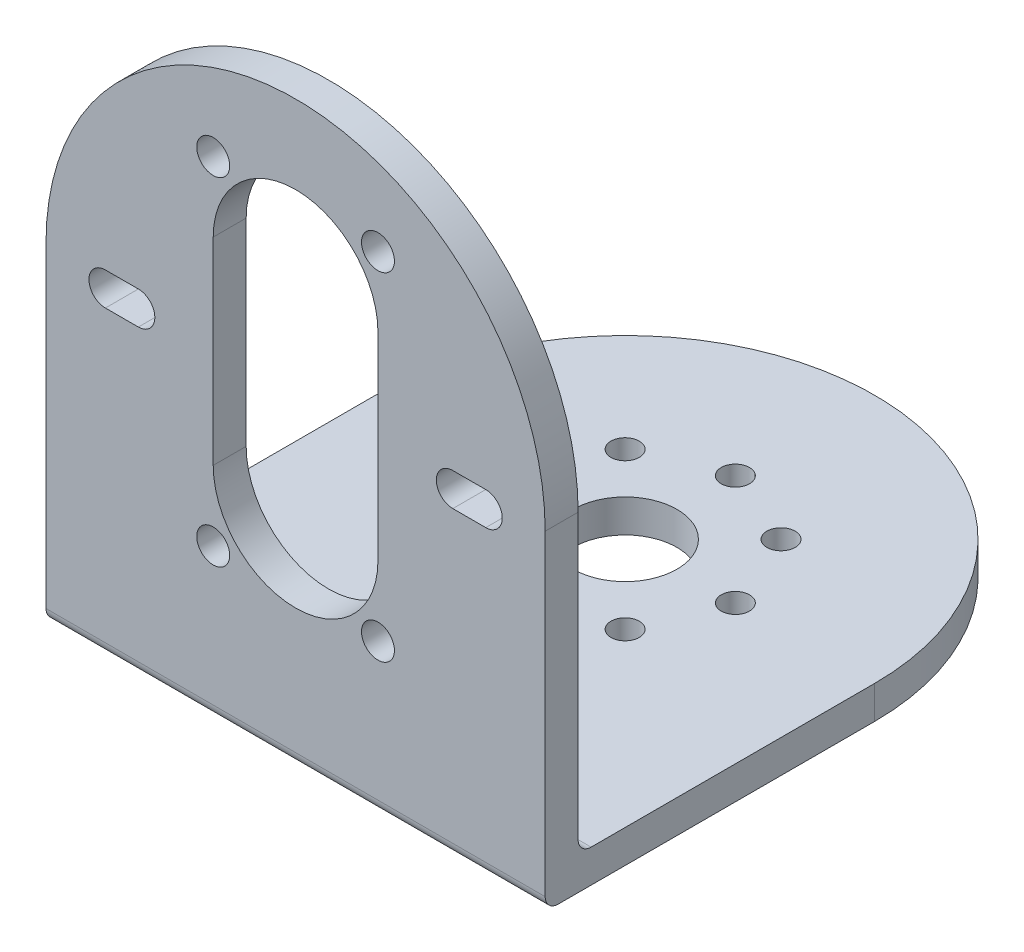
from build123d import *

# Parameters (mm, degrees)
SKETCH1_R           = 4
BOSS_EXTRUDE1_DEPTH = 2.54
SKETCH2_R           = 1.09
CUT_EXTRUDE1_DEPTH  = 5
CIRPATTERN1_COUNT   = 8
SKETCH3_R           = 1.27
BOSS_EXTRUDE2_DEPTH = 2.54
FILLET1_R           = 1


with BuildPart() as part:
    # Sketch1 → Boss-Extrude1 (new body)
    with BuildSketch(Plane(origin=(0, 0, 0), x_dir=(1, 0, 0), z_dir=(0, 1, 0))):
        with BuildLine():
            Line((-19.24, 0), (-19.24, -25.4))
            Line((-19.24, -25.4), (19.24, -25.4))
            Line((19.24, -25.4), (19.24, 0))
            ThreePointArc((19.24, 0), (0, 19.24), (-19.24, 0))
        make_face()
        with Locations(Location((0, 0, 0), (0, 0, 270))):
            Circle(SKETCH1_R, mode=Mode.SUBTRACT)
    extrude(amount=BOSS_EXTRUDE1_DEPTH)

    # Sketch2 → Cut-Extrude1 (cut, symmetric)
    with BuildSketch(Plane(origin=(0, 2.54, 0), x_dir=(1, 0, 0), z_dir=(0, 1, 0))):
        with Locations(Location((0, 8.5, 0), (0, 0, 270))):
            Circle(SKETCH2_R)
    cut_extrude1 = extrude(amount=CUT_EXTRUDE1_DEPTH, both=True, mode=Mode.SUBTRACT)

    # CirPattern1: Cut-Extrude1 ×8 about axis
    cirpattern1_axis = Axis((0, 0, 0), (0, 1, 0))
    for i in range(1, CIRPATTERN1_COUNT):
        add(cut_extrude1.rotate(cirpattern1_axis, i * 360 / CIRPATTERN1_COUNT), mode=Mode.SUBTRACT)

    # Sketch3 → Boss-Extrude2 (add)
    with BuildSketch(Plane.XY.offset(25.4)):
        with BuildLine():
            Line((19.24, 2.54), (19.24, 25.4))
            ThreePointArc((19.24, 25.4), (0, 44.64), (-19.24, 25.4))
            Line((-19.24, 25.4), (-19.24, 2.54))
            Line((-19.24, 2.54), (19.24, 2.54))
        make_face()
        with Locations((6.35, 37.62)):
            Circle(SKETCH3_R, mode=Mode.SUBTRACT)
        with Locations((6.35, 11.62)):
            Circle(SKETCH3_R, mode=Mode.SUBTRACT)
        with Locations(Location((-6.35, 11.62, 0), (0, 0, 180))):
            Circle(SKETCH3_R, mode=Mode.SUBTRACT)
        with Locations(Location((-6.35, 37.62, 0), (0, 0, 180))):
            Circle(SKETCH3_R, mode=Mode.SUBTRACT)
        with BuildLine():
            Line((6.35, 32.24), (6.35, 17))
            ThreePointArc((6.35, 17), (0, 10.65), (-6.35, 17))
            Line((-6.35, 17), (-6.35, 32.24))
            ThreePointArc((-6.35, 32.24), (0, 38.59), (6.35, 32.24))
        make_face(mode=Mode.SUBTRACT)
        with BuildLine():
            Line((14.66, 25.89), (12.12, 25.89))
            ThreePointArc((12.12, 25.89), (10.85, 24.62), (12.12, 23.35))
            Line((12.12, 23.35), (14.66, 23.35))
            ThreePointArc((14.66, 23.35), (15.93, 24.62), (14.66, 25.89))
        make_face(mode=Mode.SUBTRACT)
        with BuildLine():
            Line((-14.66, 23.35), (-12.12, 23.35))
            ThreePointArc((-12.12, 23.35), (-10.85, 24.62), (-12.12, 25.89))
            Line((-12.12, 25.89), (-14.66, 25.89))
            ThreePointArc((-14.66, 25.89), (-15.93, 24.62), (-14.66, 23.35))
        make_face(mode=Mode.SUBTRACT)
    extrude(amount=-BOSS_EXTRUDE2_DEPTH)

    # Fillet1
    fillet1_edges = [part.edges().sort_by_distance(p)[0] for p in [
        (0, 0, 25.4),
        (0, 2.54, 22.86),
    ]]
    fillet(fillet1_edges, radius=FILLET1_R)


solid = part.part
